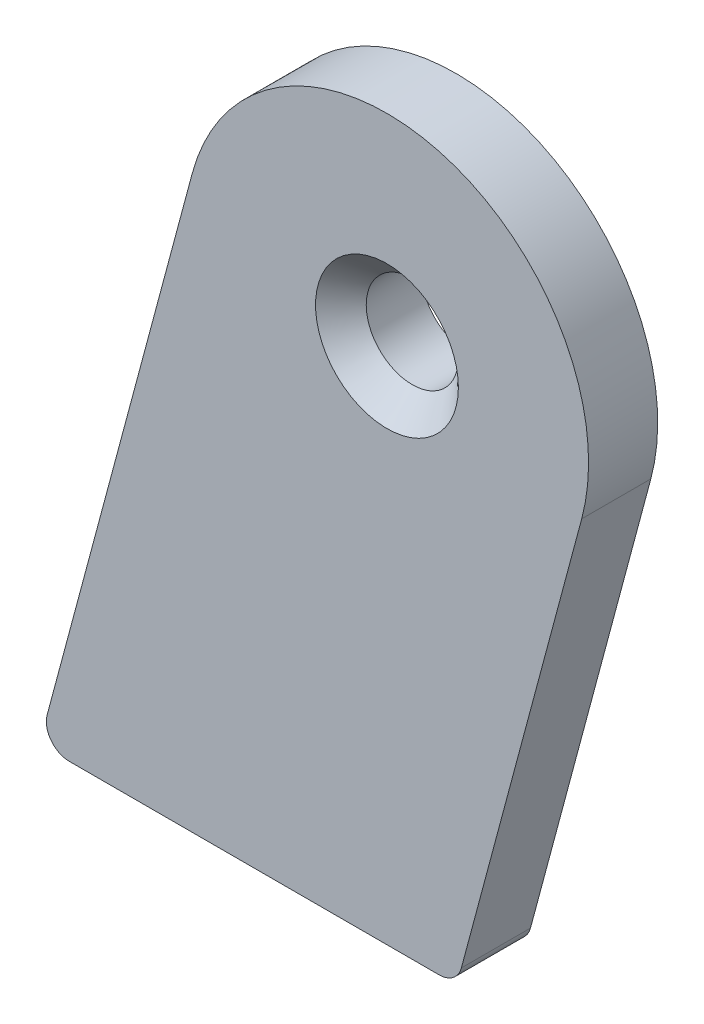
from build123d import *

# Parameters (mm, degrees)
AUFSATZ_LINEAR_START                                 = -6
AUFSATZ_LINEAR_AUSTRAGEN1_DEPTH                      = 6
VERRUNDUNG1_R                                        = 2
FORMSENKUNG_F_R_M5_LINSENSENKSCHRAUBE_MI_D           = 5.5
FORMSENKUNG_F_R_M5_LINSENSENKSCHRAUBE_MI_DEPTH       = 7
FORMSENKUNG_F_R_M5_LINSENSENKSCHRAUBE_MI_CSINK_D     = 12.4
FORMSENKUNG_F_R_M5_LINSENSENKSCHRAUBE_MI_CSINK_ANGLE = 90
AUFSATZ_LINEAR_AUSTRAGEN2_DEPTH                      = 3.5
VERRUNDUNG2_R                                        = 0.5


with BuildPart() as part:
    # Skizze1 → Rotation1 (revolve)
    with BuildSketch(Plane(origin=(0, 0, 0), x_dir=(1, 0, 0), z_dir=(0, 1, 0))):
        Polygon((48, -28), (48, -34), (34.5, -34), (34.5, -28), (46, -28), (46, -27), (48, -27), align=None)
    revolve(axis=Axis((52, 0, 28), (0, 0, 1)))

    # Skizze2 → Aufsatz-Linear austragen1 (add)
    with BuildSketch(Plane.XY.offset(34).offset(AUFSATZ_LINEAR_START)):
        with BuildLine():
            Line((21.824953183, -45), (58.059619498, -45))
            Line((58.059619498, -45), (68.90370196, -4.529333289))
            ThreePointArc((68.90370196, -4.529333289), (47.470666711, -16.90370196), (35.09629804, 4.529333289))
            Line((35.09629804, 4.529333289), (21.824953183, -45))
        make_face()
    extrude(amount=AUFSATZ_LINEAR_AUSTRAGEN1_DEPTH)

    # Verrundung1
    verrundung1_edges = [part.edges().sort_by_distance(p)[0] for p in [
        (21.824953183, -45, 31),
        (58.059619498, -45, 31),
    ]]
    fillet(verrundung1_edges, radius=VERRUNDUNG1_R)

    # Formsenkung für M5 Linsensenkschraube mit Schlitz1
    with Locations(Plane.XY.offset(34)):
        with Locations((52, 0)):
            CounterSinkHole(FORMSENKUNG_F_R_M5_LINSENSENKSCHRAUBE_MI_D / 2, FORMSENKUNG_F_R_M5_LINSENSENKSCHRAUBE_MI_CSINK_D / 2, depth=FORMSENKUNG_F_R_M5_LINSENSENKSCHRAUBE_MI_DEPTH, counter_sink_angle=FORMSENKUNG_F_R_M5_LINSENSENKSCHRAUBE_MI_CSINK_ANGLE)

    # Skizze5 → Aufsatz-Linear austragen2 (add)
    with BuildSketch(Plane(origin=(0, 0, 28), x_dir=(-1, 0, 0), z_dir=(0, 0, -1))):
        with BuildLine():
            Line((-62.329377095, -10.176147052), (-61.098191234, -8.571634399))
            ThreePointArc((-61.098191234, -8.571634399), (-59.609517863, -9.916916754), (-57.924777873, -11.006680115))
            Line((-57.924777873, -11.006680115), (-59.155963734, -12.611192768))
            ThreePointArc((-59.155963734, -12.611192768), (-60.01066697, -12.086323457), (-60.827040721, -11.503623434))
            ThreePointArc((-60.827040721, -11.503623434), (-61.601178796, -10.865880808), (-62.329377095, -10.176147052))
        make_face()
    extrude(amount=AUFSATZ_LINEAR_AUSTRAGEN2_DEPTH)

    # Verrundung2
    verrundung2_edges = [part.edges().sort_by_distance(p)[0] for p in [
        (62.329377095, -10.176147052, 26.25),
        (59.155963734, -12.611192768, 26.25),
        (57.924777873, -11.006680115, 26.25),
        (61.098191234, -8.571634399, 26.25),
    ]]
    fillet(verrundung2_edges, radius=VERRUNDUNG2_R)


solid = part.part
